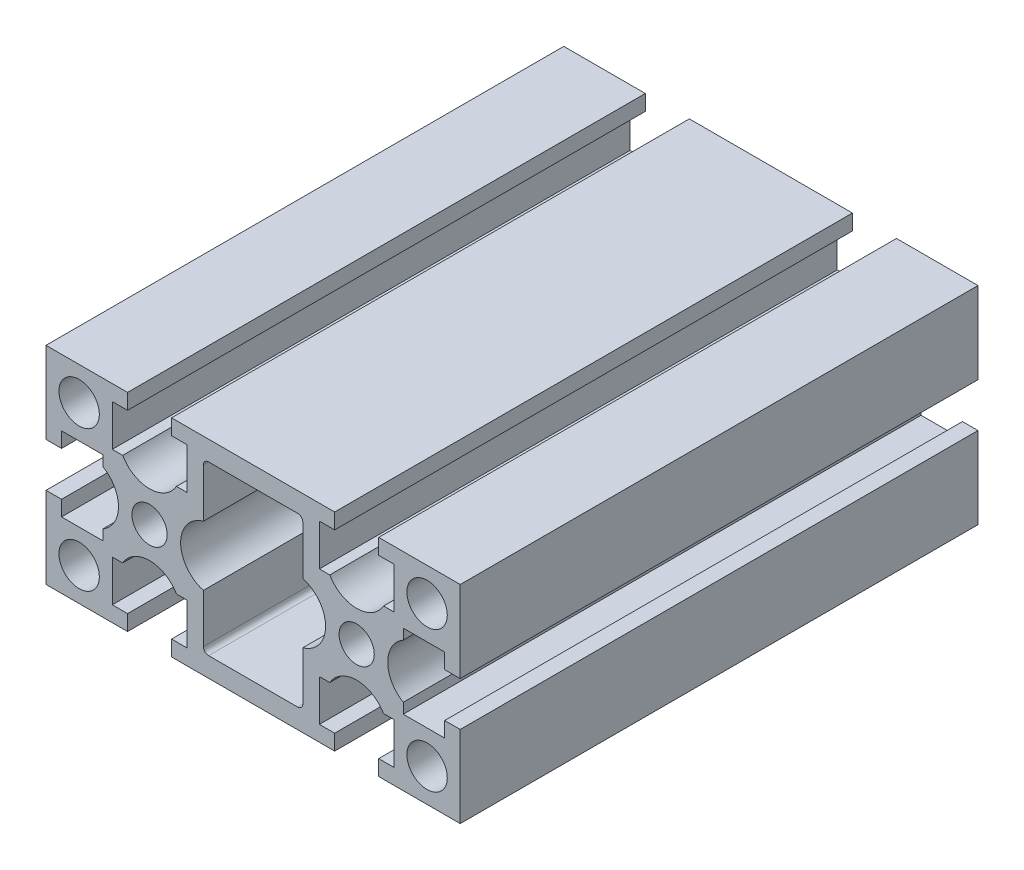
from build123d import *

# Parameters (mm, degrees)
SKETCH_1_R      = 3.9
SKETCH_1_R_2    = 3.4
EXTRUDE_1_DEPTH = 100


with BuildPart() as part:
    # 草图1 → 凸台-拉伸1 (new body)
    with BuildSketch(Plane.XY):
        with BuildLine():
            Line((-24.732808051, 19.848597475), (-40.482808051, 19.848597475))
            Line((-40.482808051, 19.848597475), (-40.482808051, 4.098597475))
            Line((-40.482808051, 4.098597475), (-37.482808051, 4.098597475))
            Line((-37.482808051, 4.098597475), (-37.482808051, 7.048597475))
            Line((-37.482808051, 7.048597475), (-29.482808051, 7.048597475))
            Line((-29.482808051, 7.048597475), (-29.482808051, 5.044749898))
            ThreePointArc((-29.482808051, 5.044749898), (-26.482808051, -0.151402525), (-29.482808051, -5.347554947))
            Line((-29.482808051, -5.347554947), (-29.482808051, -7.351402525))
            Line((-29.482808051, -7.351402525), (-37.482808051, -7.351402525))
            Line((-37.482808051, -7.351402525), (-37.482808051, -4.401402525))
            Line((-37.482808051, -4.401402525), (-40.482808051, -4.401402525))
            Line((-40.482808051, -4.401402525), (-40.482808051, -20.151402525))
            Line((-40.482808051, -20.151402525), (-24.732808051, -20.151402525))
            Line((-24.732808051, -20.151402525), (-24.732808051, -17.151402525))
            Line((-24.732808051, -17.151402525), (-27.682808051, -17.151402525))
            Line((-27.682808051, -17.151402525), (-27.682808051, -9.151402525))
            Line((-27.682808051, -9.151402525), (-25.678960473, -9.151402525))
            ThreePointArc((-25.678960473, -9.151402525), (-20.482808051, -6.151402525), (-15.286655628, -9.151402525))
            Line((-15.286655628, -9.151402525), (-13.282808051, -9.151402525))
            Line((-13.282808051, -9.151402525), (-13.282808051, -17.151402525))
            Line((-13.282808051, -17.151402525), (-16.232808051, -17.151402525))
            Line((-16.232808051, -17.151402525), (-16.232808051, -20.151402525))
            Line((-16.232808051, -20.151402525), (-0.482808051, -20.151402525))
            Line((-0.482808051, -20.151402525), (15.267191949, -20.151402525))
            Line((15.267191949, -20.151402525), (15.267191949, -17.151402525))
            Line((15.267191949, -17.151402525), (12.317191949, -17.151402525))
            Line((12.317191949, -17.151402525), (12.317191949, -9.151402525))
            Line((12.317191949, -9.151402525), (14.321039527, -9.151402525))
            ThreePointArc((14.321039527, -9.151402525), (19.517191949, -6.151402525), (24.713344372, -9.151402525))
            Line((24.713344372, -9.151402525), (26.717191949, -9.151402525))
            Line((26.717191949, -9.151402525), (26.717191949, -17.151402525))
            Line((26.717191949, -17.151402525), (23.767191949, -17.151402525))
            Line((23.767191949, -17.151402525), (23.767191949, -20.151402525))
            Line((23.767191949, -20.151402525), (39.517191949, -20.151402525))
            Line((39.517191949, -20.151402525), (39.517191949, -4.401402525))
            Line((39.517191949, -4.401402525), (36.517191949, -4.401402525))
            Line((36.517191949, -4.401402525), (36.517191949, -7.351402525))
            Line((36.517191949, -7.351402525), (28.517191949, -7.351402525))
            Line((28.517191949, -7.351402525), (28.517191949, -5.347554947))
            ThreePointArc((28.517191949, -5.347554947), (25.517191949, -0.151402525), (28.517191949, 5.044749898))
            Line((28.517191949, 5.044749898), (28.517191949, 7.048597475))
            Line((28.517191949, 7.048597475), (36.517191949, 7.048597475))
            Line((36.517191949, 7.048597475), (36.517191949, 4.098597475))
            Line((36.517191949, 4.098597475), (39.517191949, 4.098597475))
            Line((39.517191949, 4.098597475), (39.517191949, 19.848597475))
            Line((39.517191949, 19.848597475), (23.767191949, 19.848597475))
            Line((23.767191949, 19.848597475), (23.767191949, 16.848597475))
            Line((23.767191949, 16.848597475), (26.717191949, 16.848597475))
            Line((26.717191949, 16.848597475), (26.717191949, 8.848597475))
            Line((26.717191949, 8.848597475), (24.713344372, 8.848597475))
            ThreePointArc((24.713344372, 8.848597475), (19.517191949, 5.848597475), (14.321039527, 8.848597475))
            Line((14.321039527, 8.848597475), (12.317191949, 8.848597475))
            Line((12.317191949, 8.848597475), (12.317191949, 16.848597475))
            Line((12.317191949, 16.848597475), (15.267191949, 16.848597475))
            Line((15.267191949, 16.848597475), (15.267191949, 19.848597475))
            Line((15.267191949, 19.848597475), (-0.482808051, 19.848597475))
            Line((-0.482808051, 19.848597475), (-16.232808051, 19.848597475))
            Line((-16.232808051, 19.848597475), (-16.232808051, 16.848597475))
            Line((-16.232808051, 16.848597475), (-13.282808051, 16.848597475))
            Line((-13.282808051, 16.848597475), (-13.282808051, 8.848597475))
            Line((-13.282808051, 8.848597475), (-15.286655628, 8.848597475))
            ThreePointArc((-15.286655628, 8.848597475), (-20.482808051, 5.848597475), (-25.678960473, 8.848597475))
            Line((-25.678960473, 8.848597475), (-27.682808051, 8.848597475))
            Line((-27.682808051, 8.848597475), (-27.682808051, 16.848597475))
            Line((-27.682808051, 16.848597475), (-24.732808051, 16.848597475))
            Line((-24.732808051, 16.848597475), (-24.732808051, 19.848597475))
        make_face()
        with Locations((-34.082808051, 13.448597475)):
            Circle(SKETCH_1_R, mode=Mode.SUBTRACT)
        with Locations((-34.082808051, -13.751402525)):
            Circle(SKETCH_1_R, mode=Mode.SUBTRACT)
        with Locations((-20.482808051, -0.151402525)):
            Circle(SKETCH_1_R_2, mode=Mode.SUBTRACT)
        with Locations((33.117191949, 13.448597475)):
            Circle(SKETCH_1_R, mode=Mode.SUBTRACT)
        with Locations((33.117191949, -13.751402525)):
            Circle(SKETCH_1_R, mode=Mode.SUBTRACT)
        with Locations((19.517191949, -0.151402525)):
            Circle(SKETCH_1_R_2, mode=Mode.SUBTRACT)
        with BuildLine():
            Line((-10.082808051, 15.048597475), (-10.082808051, 5.631330393))
            ThreePointArc((-10.082808051, 5.631330393), (-14.482808051, -0.151402525), (-10.082808051, -5.934135442))
            Line((-10.082808051, -5.934135442), (-10.082808051, -15.351402525))
            ThreePointArc((-10.082808051, -15.351402525), (-9.789914832, -16.058509306), (-9.082808051, -16.351402525))
            Line((-9.082808051, -16.351402525), (8.117191949, -16.351402525))
            ThreePointArc((8.117191949, -16.351402525), (8.824298731, -16.058509306), (9.117191949, -15.351402525))
            Line((9.117191949, -15.351402525), (9.117191949, -5.934135442))
            ThreePointArc((9.117191949, -5.934135442), (13.517191949, -0.151402525), (9.117191949, 5.631330393))
            Line((9.117191949, 5.631330393), (9.117191949, 15.048597475))
            ThreePointArc((9.117191949, 15.048597475), (8.824298731, 15.755704257), (8.117191949, 16.048597475))
            Line((8.117191949, 16.048597475), (-9.082808051, 16.048597475))
            ThreePointArc((-9.082808051, 16.048597475), (-9.789914832, 15.755704257), (-10.082808051, 15.048597475))
        make_face(mode=Mode.SUBTRACT)
    extrude(amount=EXTRUDE_1_DEPTH)


solid = part.part
